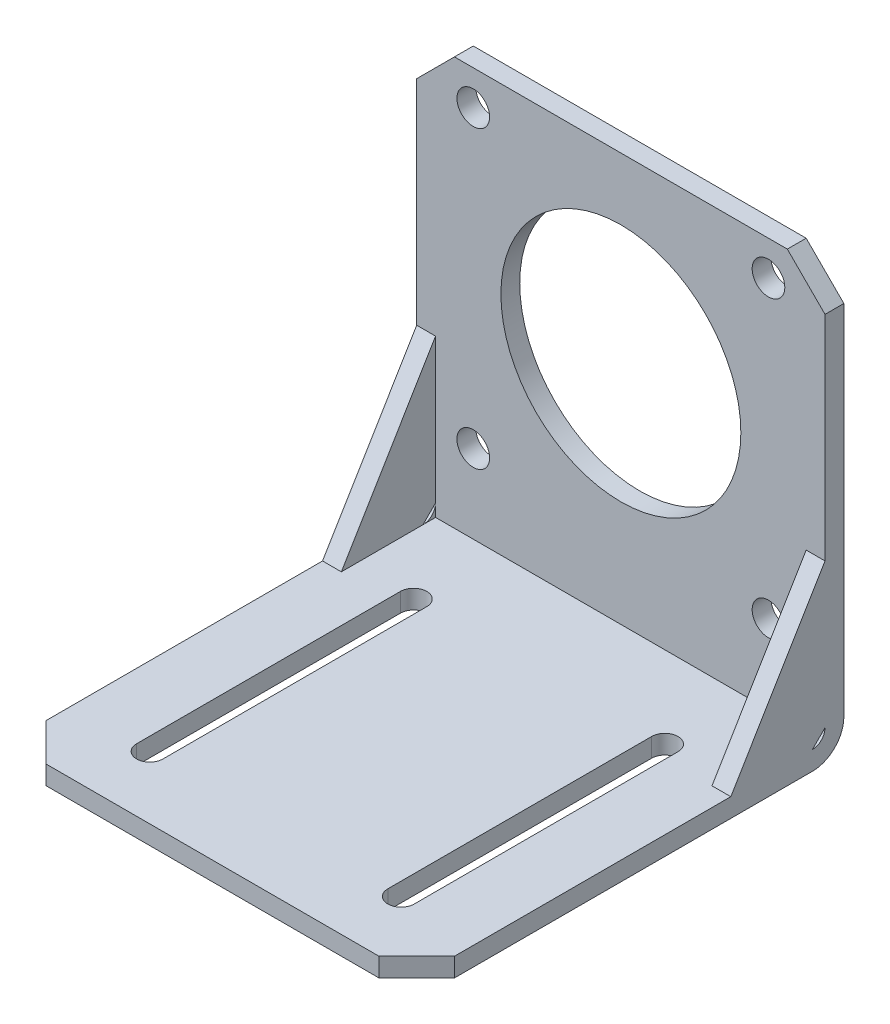
from build123d import *

# Parameters (mm, degrees)
SKETCH1_R           = 19.1
SKETCH1_R_2         = 2.6
BOSS_EXTRUDE1_DEPTH = 3
SKETCH2_W           = 68
SKETCH2_H           = 3
BOSS_EXTRUDE2_DEPTH = 65
BOSS_EXTRUDE3_DEPTH = 3
BOSS_EXTRUDE4_DEPTH = 3
CUT_EXTRUDE1_DEPTH  = 3
CUT_EXTRUDE2_DEPTH  = 65


with BuildPart() as part:
    # Sketch1 → Boss-Extrude1 (new body)
    with BuildSketch(Plane.XY):
        Polygon((-32.5, 59), (-32.5, 0), (32.5, 0), (32.5, 59), (26.5, 65), (-26.5, 65), align=None)
        with Locations((0, 36)):
            Circle(SKETCH1_R, mode=Mode.SUBTRACT)
        with Locations((-23.5, 59.5)):
            Circle(SKETCH1_R_2, mode=Mode.SUBTRACT)
        with Locations((23.5, 59.5)):
            Circle(SKETCH1_R_2, mode=Mode.SUBTRACT)
        with Locations((23.5, 12.5)):
            Circle(SKETCH1_R_2, mode=Mode.SUBTRACT)
        with Locations((-23.5, 12.5)):
            Circle(SKETCH1_R_2, mode=Mode.SUBTRACT)
    extrude(amount=BOSS_EXTRUDE1_DEPTH)

    # Sketch2 → Boss-Extrude2 (add)
    with BuildSketch(Plane.ZY.offset(32.5)):
        with Locations((34, -1.5)):
            Rectangle(SKETCH2_W, SKETCH2_H)
    extrude(amount=-BOSS_EXTRUDE2_DEPTH)

    # Sketch3 → Boss-Extrude3 (add)
    with BuildSketch(Plane.ZY.offset(32.5)):
        Polygon((3, 25), (18, 0), (3, 0), align=None)
    extrude(amount=-BOSS_EXTRUDE3_DEPTH)

    # Sketch4 → Boss-Extrude4 (add)
    with BuildSketch(Plane(origin=(32.5, 0, 0), x_dir=(0, 0, -1), z_dir=(1, 0, 0))):
        Polygon((-3, 0), (-18, 0), (-3, 25), align=None)
    extrude(amount=-BOSS_EXTRUDE4_DEPTH)

    # Sketch5 → Cut-Extrude1 (cut)
    with BuildSketch(Plane(origin=(0, 0, 0), x_dir=(1, 0, 0), z_dir=(0, 1, 0))):
        Polygon((-32.5, -68), (-32.5, -62), (-26.5, -68), align=None)
        Polygon((32.5, -68), (32.5, -62), (26.5, -68), align=None)
        with BuildLine():
            Line((17.9, -58), (17.9, -16))
            ThreePointArc((17.9, -16), (20, -13.9), (22.1, -16))
            Line((22.1, -16), (22.1, -58))
            ThreePointArc((22.1, -58), (20, -60.1), (17.9, -58))
        make_face()
        with BuildLine():
            Line((-22.1, -58), (-22.1, -16))
            ThreePointArc((-22.1, -16), (-20, -13.9), (-17.9, -16))
            Line((-17.9, -16), (-17.9, -58))
            ThreePointArc((-17.9, -58), (-20, -60.1), (-22.1, -58))
        make_face()
    extrude(amount=-CUT_EXTRUDE1_DEPTH, mode=Mode.SUBTRACT)

    # Sketch6 → Cut-Extrude2 (cut)
    with BuildSketch(Plane.ZY.offset(32.5)):
        with BuildLine():
            Line((0, -3), (5, -3))
            ThreePointArc((5, -3), (1.464466094, -1.535533906), (0, 2))
            Line((0, 2), (0, -3))
        make_face()
        with BuildLine():
            Line((3.002550682, 2), (5.002550682, 0))
            ThreePointArc((5.002550682, 0), (3.58833712, 0.585786438), (3.002550682, 2))
        make_face()
    extrude(amount=-CUT_EXTRUDE2_DEPTH, mode=Mode.SUBTRACT)


solid = part.part
